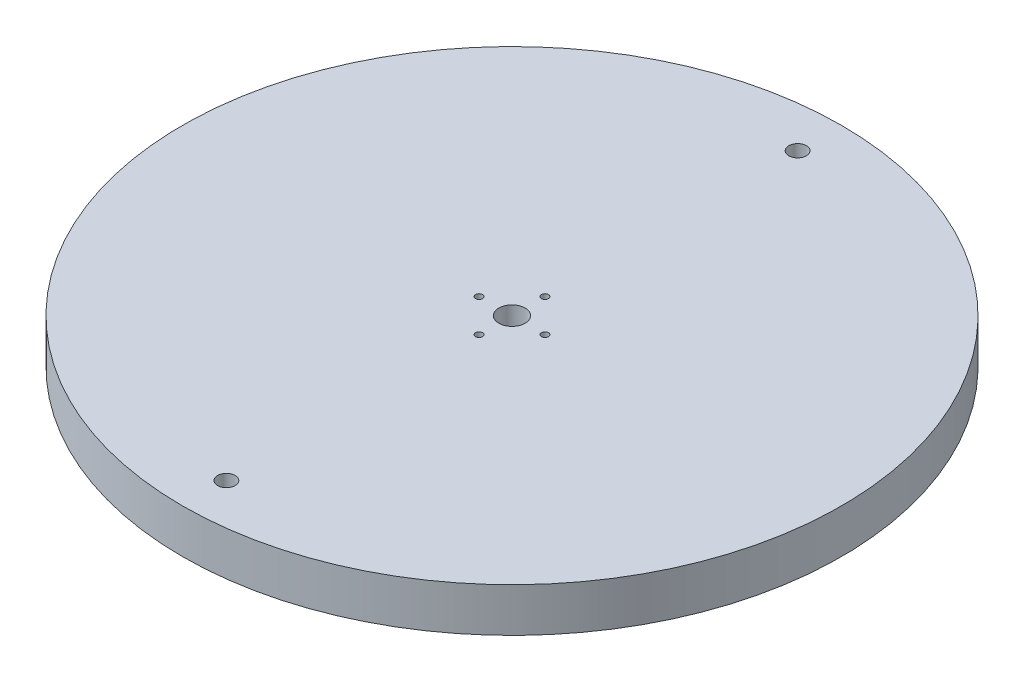
from build123d import *

# Parameters (mm, degrees)
ESQUISSE1_R        = 75
ESQUISSE1_R_2      = 0.8
ESQUISSE1_R_3      = 3
ESQUISSE1_R_4      = 2
BOSS_EXTRU_1_DEPTH = 10


with BuildPart() as part:
    # Esquisse1 → Boss.-Extru.1 (new body)
    with BuildSketch(Plane(origin=(0, 0, 0), x_dir=(1, 0, 0), z_dir=(0, 1, 0))):
        with Locations(Location((0, 0, 0), (0, 0, 270))):
            Circle(ESQUISSE1_R)
        with Locations(Location((0, -7.5, 0), (0, 0, 270))):
            Circle(ESQUISSE1_R_2, mode=Mode.SUBTRACT)
        with Locations(Location((-7.5, 0, 0), (0, 0, 270))):
            Circle(ESQUISSE1_R_2, mode=Mode.SUBTRACT)
        with Locations(Location((0, 7.5, 0), (0, 0, 270))):
            Circle(ESQUISSE1_R_2, mode=Mode.SUBTRACT)
        with Locations(Location((7.5, 0, 0), (0, 0, 270))):
            Circle(ESQUISSE1_R_2, mode=Mode.SUBTRACT)
        with Locations(Location((0, 0, 0), (0, 0, 270))):
            Circle(ESQUISSE1_R_3, mode=Mode.SUBTRACT)
        with Locations(Location((0, 65, 0), (0, 0, 270))):
            Circle(ESQUISSE1_R_4, mode=Mode.SUBTRACT)
        with Locations(Location((0, -65, 0), (0, 0, 270))):
            Circle(ESQUISSE1_R_4, mode=Mode.SUBTRACT)
    extrude(amount=BOSS_EXTRU_1_DEPTH)


solid = part.part
